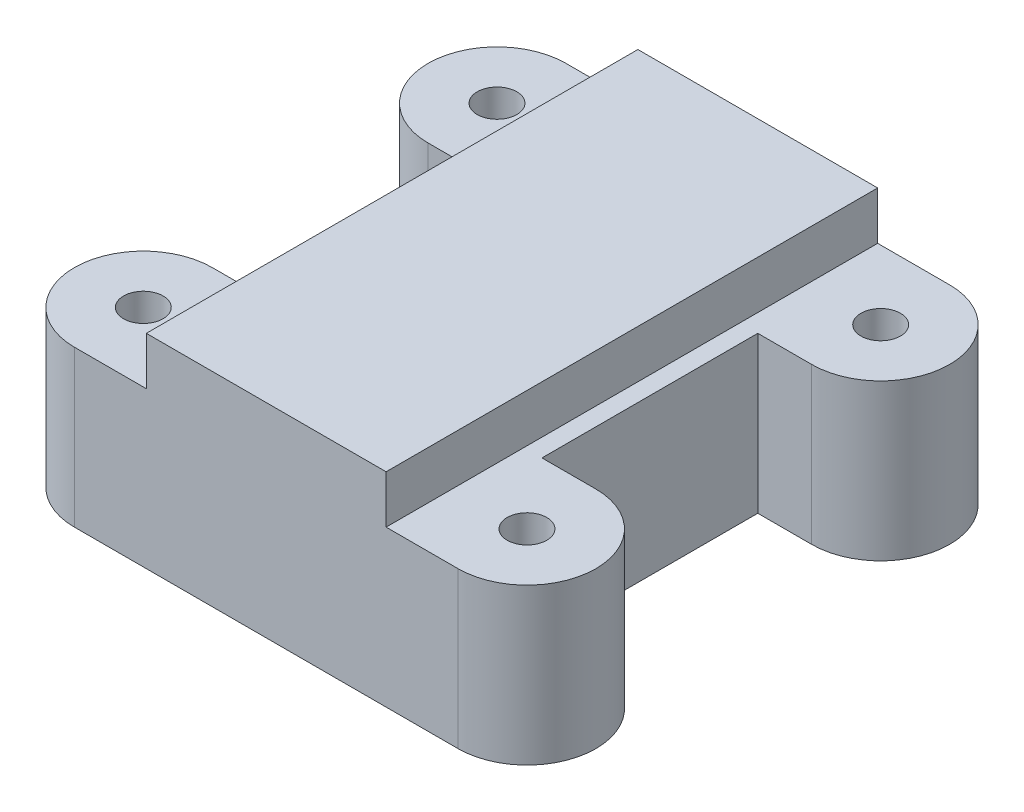
from build123d import *

# Parameters (mm, degrees)
SKETCH1_R           = 1.65
BOSS_EXTRUDE1_DEPTH = 13
SKETCH2_W           = 20
SKETCH2_H           = 41
BOSS_EXTRUDE2_DEPTH = 4


with BuildPart() as part:
    # Sketch1 → Boss-Extrude1 (new body)
    with BuildSketch(Plane(origin=(0, 0, 0), x_dir=(1, 0, 0), z_dir=(0, 1, 0))):
        with BuildLine():
            Line((-16, 9), (-11.5, 9))
            Line((-11.5, 9), (-11.5, -9))
            Line((-11.5, -9), (-16, -9))
            ThreePointArc((-16, -9), (-21.75, -14.75), (-16, -20.5))
            Line((-16, -20.5), (16, -20.5))
            ThreePointArc((16, -20.5), (21.75, -14.75), (16, -9))
            Line((16, -9), (11.5, -9))
            Line((11.5, -9), (11.5, 9))
            Line((11.5, 9), (16, 9))
            ThreePointArc((16, 9), (21.75, 14.75), (16, 20.5))
            Line((16, 20.5), (-16, 20.5))
            ThreePointArc((-16, 20.5), (-21.75, 14.75), (-16, 9))
        make_face()
        with Locations(Location((-16, 14.75, 0), (0, 0, 90))):
            Circle(SKETCH1_R, mode=Mode.SUBTRACT)
        with Locations(Location((16, 14.75, 0), (0, 0, 90))):
            Circle(SKETCH1_R, mode=Mode.SUBTRACT)
        with Locations(Location((16, -14.75, 0), (0, 0, 90))):
            Circle(SKETCH1_R, mode=Mode.SUBTRACT)
        with Locations(Location((-16, -14.75, 0), (0, 0, 90))):
            Circle(SKETCH1_R, mode=Mode.SUBTRACT)
    extrude(amount=BOSS_EXTRUDE1_DEPTH)

    # Sketch2 → Boss-Extrude2 (add)
    with BuildSketch(Plane(origin=(0, 13, 0), x_dir=(1, 0, 0), z_dir=(0, 1, 0))):
        Rectangle(SKETCH2_W, SKETCH2_H)
    extrude(amount=BOSS_EXTRUDE2_DEPTH)


solid = part.part
